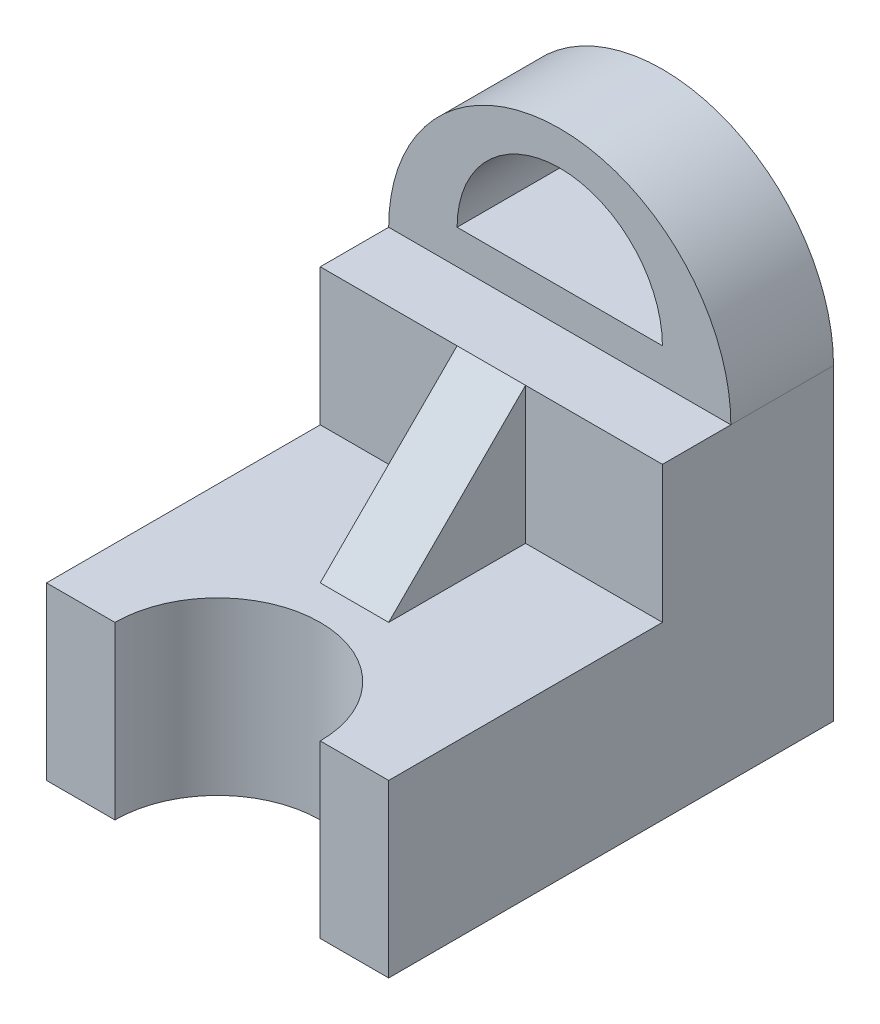
from build123d import *

# Parameters (mm, degrees)
SKETCH1_W           = 90
SKETCH1_H           = 45
BOSS_EXTRUDE1_DEPTH = 117
SKETCH1_3_W         = 90
SKETCH1_3_H         = 36
BOSS_EXTRUDE2_DEPTH = 45
BOSS_EXTRUDE3_DEPTH = 27
CUT_EXTRUDE1_REACH  = 151.248
BOSS_EXTRUDE4_DEPTH = 9


with BuildPart() as part:
    # Sketch1 → Boss-Extrude1 (new body)
    with BuildSketch(Plane.XY):
        with Locations((0, 22.5)):
            Rectangle(SKETCH1_W, SKETCH1_H)
    extrude(amount=BOSS_EXTRUDE1_DEPTH)

    # Sketch1<3> → Boss-Extrude2 (add)
    with BuildSketch(Plane.XY):
        with Locations((0, 63)):
            Rectangle(SKETCH1_3_W, SKETCH1_3_H)
    extrude(amount=BOSS_EXTRUDE2_DEPTH)

    # Sketch1<4> → Boss-Extrude3 (add)
    with BuildSketch(Plane.XY):
        with BuildLine():
            Line((-45, 81), (45, 81))
            ThreePointArc((45, 81), (0, 126), (-45, 81))
        make_face()
        with BuildLine():
            ThreePointArc((-27, 90), (0, 117), (27, 90))
            Line((27, 90), (-27, 90))
        make_face(mode=Mode.SUBTRACT)
    extrude(amount=BOSS_EXTRUDE3_DEPTH)

    # Sketch5 → Cut-Extrude1 (cut, up to next)
    with BuildSketch(Plane(origin=(0, 45, 0), x_dir=(1, 0, 0), z_dir=(0, 1, 0)), mode=Mode.PRIVATE) as cut_extrude1_sk1:
        with BuildLine():
            Line((-27, -117), (27, -117))
            ThreePointArc((27, -117), (0, -90), (-27, -117))
        make_face()
    cut_extrude1_tool1 = extrude(cut_extrude1_sk1.sketch, amount=-CUT_EXTRUDE1_REACH, mode=Mode.PRIVATE) & part.part
    add(cut_extrude1_tool1.solids().sort_by_distance((0, 45, 105.540844))[0], mode=Mode.SUBTRACT)

    # Sketch7 → Boss-Extrude4 (add, symmetric)
    with BuildSketch(Plane(origin=(0, 0, 0), x_dir=(0, 0, -1), z_dir=(1, 0, 0))):
        Polygon((-45, 81), (-81, 45), (-45, 45), align=None)
    extrude(amount=BOSS_EXTRUDE4_DEPTH, both=True)


solid = part.part
